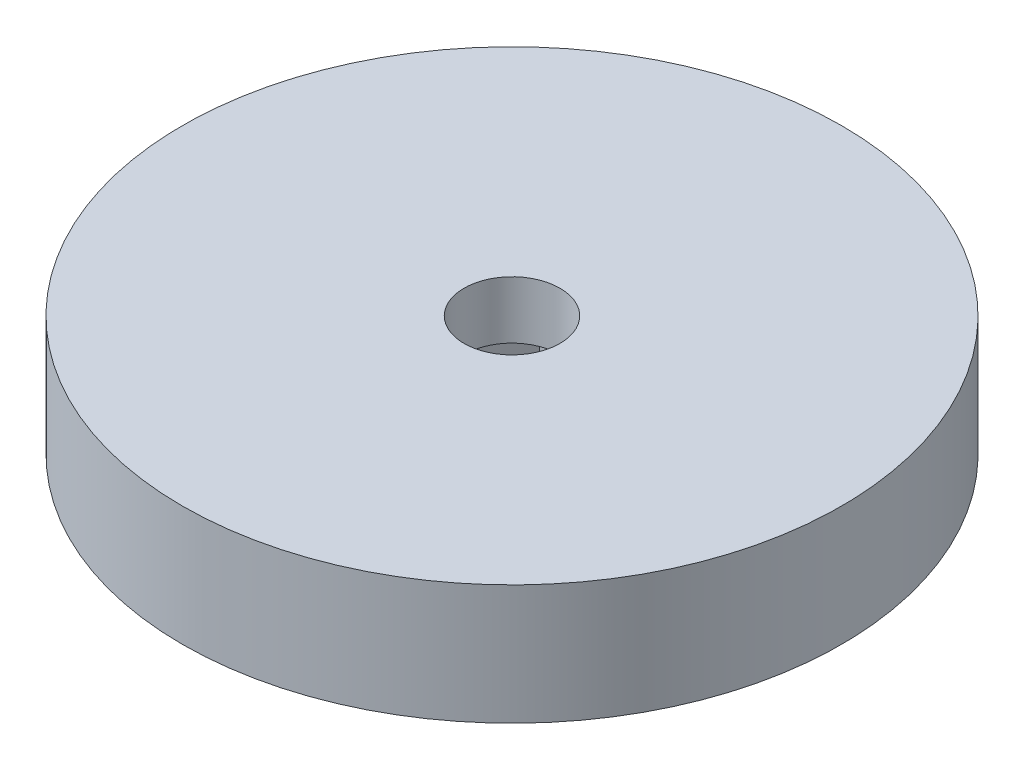
from build123d import *

# Parameters (mm, degrees)
SKETCH1_R              = 34.384
BOSS_EXTRUDE1_DEPTH    = 12.5
F_10_0MM_DOWEL_HOLE1_D = 10
CUT_EXTRUDE1_DEPTH     = 6.5


with BuildPart() as part:
    # Sketch1 → Boss-Extrude1 (new body)
    with BuildSketch(Plane(origin=(0, 0, 0), x_dir=(1, 0, 0), z_dir=(0, 1, 0))):
        with Locations(Location((0, 0, 0), (0, 0, 270))):
            Circle(SKETCH1_R)
    extrude(amount=BOSS_EXTRUDE1_DEPTH)

    # Ø10.0mm Dowel Hole1 (through all)
    with Locations(Plane(origin=(0, 0, 0), x_dir=(-1, 0, 0), z_dir=(0, -1, 0))):
        with Locations((0, 0)):
            Hole(F_10_0MM_DOWEL_HOLE1_D / 2)

    # Sketch4 → Cut-Extrude1 (cut)
    with BuildSketch(Plane(origin=(0, 0, 0), x_dir=(-1, 0, 0), z_dir=(0, -1, 0))):
        Polygon((-3.897114317, -6.75), (3.897114317, -6.75), (7.794228634, 0), (3.897114317, 6.75), (-3.897114317, 6.75), (-7.794228634, 0), align=None)
    extrude(amount=-CUT_EXTRUDE1_DEPTH, mode=Mode.SUBTRACT)


solid = part.part
